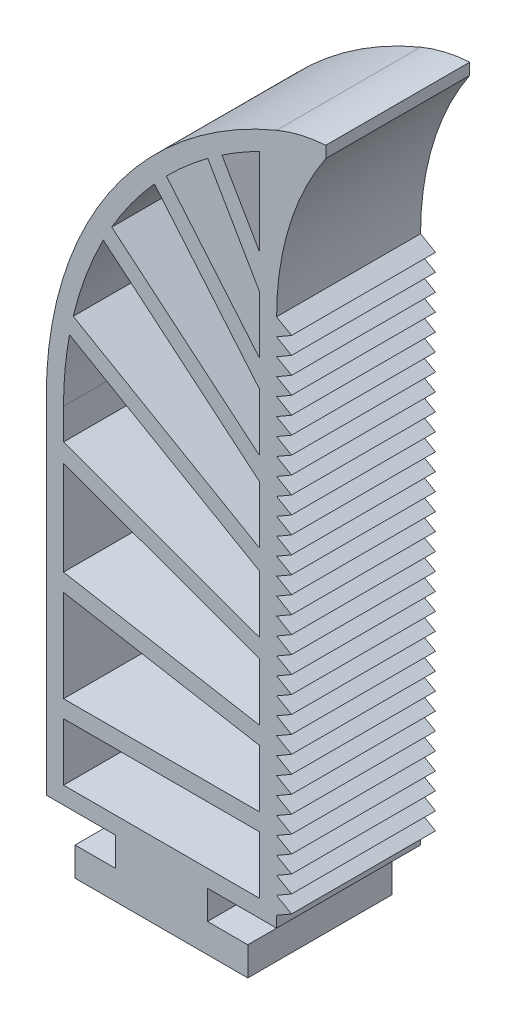
from build123d import *

# Parameters (mm, degrees)
BOSS_EXTRUDE1_DEPTH = 25
SKETCH3_W           = 34
SKETCH3_H           = 10
CUT_EXTRUDE1_DEPTH  = 134.88427839
CUT_EXTRUDE2_DEPTH  = 134.88427839
CUT_EXTRUDE3_DEPTH  = 134.88427839
CUT_EXTRUDE4_DEPTH  = 134.88427839
BOSS_EXTRUDE2_DEPTH = 25
BOSS_EXTRUDE3_DEPTH = 25
LPATTERN1_COUNT     = 30
LPATTERN1_PITCH     = 3
CUT_EXTRUDE5_DEPTH  = 138.359842306
CUT_EXTRUDE6_DEPTH  = 138.359842306
CUT_EXTRUDE7_DEPTH  = 138.359842306
CUT_EXTRUDE8_DEPTH  = 138.359842306


with BuildPart() as part:
    # Sketch2 → Boss-Extrude1 (new body)
    with BuildSketch(Plane.XY):
        with BuildLine():
            Line((-15, 0), (15, 0))
            Line((15, 0), (15, 5))
            Line((15, 5), (8, 5))
            Line((8, 5), (8, 10))
            Line((8, 10), (20, 10))
            Line((20, 10), (20, 130))
            ThreePointArc((20, 130), (-9.083269132, 106.055512755), (-20, 70))
            Line((-20, 70), (-20, 10))
            Line((-20, 10), (-8, 10))
            Line((-8, 10), (-8, 5))
            Line((-8, 5), (-15, 5))
            Line((-15, 5), (-15, 0))
        make_face()
    extrude(amount=BOSS_EXTRUDE1_DEPTH)

    # Sketch3 → Cut-Extrude1 (cut, through all)
    with BuildSketch(Plane.XY.offset(25)):
        with Locations((0, 18)):
            Rectangle(SKETCH3_W, SKETCH3_H)
    extrude(amount=-CUT_EXTRUDE1_DEPTH, mode=Mode.SUBTRACT)

    # Sketch4 → Cut-Extrude2 (cut, through all)
    with BuildSketch(Plane.XY.offset(25)):
        Polygon((-17, 26), (17, 26), (17, 36), (-17, 41.995117344), align=None)
    extrude(amount=-CUT_EXTRUDE2_DEPTH, mode=Mode.SUBTRACT)

    # Sketch5 → Cut-Extrude3 (cut, through all)
    with BuildSketch(Plane.XY.offset(25)):
        Polygon((-17, 45.04139718), (17, 39.046279836), (17, 49.046279836), (-17, 61.421267801), align=None)
    extrude(amount=-CUT_EXTRUDE3_DEPTH, mode=Mode.SUBTRACT)

    # Sketch6 → Cut-Extrude4 (cut, through all)
    with BuildSketch(Plane.XY.offset(25)):
        with BuildLine():
            Line((-17, 64.613801118), (17, 52.238813153))
            Line((17, 52.238813153), (17, 62.238813153))
            Line((17, 62.238813153), (-15.966701553, 81.272147169))
            ThreePointArc((-15.966701553, 81.272147169), (-16.741134976, 75.659704221), (-17, 70))
            Line((-17, 70), (-17, 64.613801118))
        make_face()
    extrude(amount=-CUT_EXTRUDE4_DEPTH, mode=Mode.SUBTRACT)

    # Sketch13 → Boss-Extrude2 (add)
    with BuildSketch(Plane.XY.offset(25)):
        with BuildLine():
            Line((28.543587015, 132.015112463), (28.543587015, 130.015112463))
            ThreePointArc((28.543587015, 130.015112463), (22.183163486, 116.610368534), (20, 101.934676234))
            Line((20, 101.934676234), (20, 130))
            ThreePointArc((20, 130), (24.189413282, 131.356828362), (28.543587015, 132.015112463))
        make_face()
    extrude(amount=-BOSS_EXTRUDE2_DEPTH)

    # Sketch15 → Boss-Extrude3 (add)
    with BuildSketch(Plane.XY.offset(25)):
        Polygon((20, 101.934676234), (22.598076211, 100.434676234), (20, 98.934676234), align=None)
    boss_extrude3 = extrude(amount=-BOSS_EXTRUDE3_DEPTH)

    # LPattern1: Boss-Extrude3 ×30
    with Locations(*[(0, -i * LPATTERN1_PITCH, 0) for i in range(1, LPATTERN1_COUNT)]):
        add(boss_extrude3)

    # Sketch17 → Cut-Extrude5 (cut, through all)
    with BuildSketch(Plane.XY.offset(25)):
        with BuildLine():
            Line((-15.314209237, 84.35953217), (17, 65.702914768))
            Line((17, 65.702914768), (17, 75.702914768))
            Line((17, 75.702914768), (-10.093752299, 98.43727233))
            ThreePointArc((-10.093752299, 98.43727233), (-13.131704676, 91.557015366), (-15.314209237, 84.35953217))
        make_face()
    extrude(amount=-CUT_EXTRUDE5_DEPTH, mode=Mode.SUBTRACT)

    # Sketch18 → Cut-Extrude6 (cut, through all)
    with BuildSketch(Plane.XY.offset(25)):
        with BuildLine():
            Line((-8.623988609, 101.120216028), (17, 79.619136636))
            Line((17, 79.619136636), (17, 89.619136636))
            Line((17, 89.619136636), (-1.21635527, 111.328543473))
            ThreePointArc((-1.21635527, 111.328543473), (-5.18043497, 106.413238612), (-8.623988609, 101.120216028))
        make_face()
    extrude(amount=-CUT_EXTRUDE6_DEPTH, mode=Mode.SUBTRACT)

    # Sketch19 → Cut-Extrude7 (cut, through all)
    with BuildSketch(Plane.XY.offset(25)):
        with BuildLine():
            Line((0.851852517, 113.530920893), (17, 94.286308117))
            Line((17, 94.286308117), (17, 104.286308117))
            Line((17, 104.286308117), (8.050664287, 119.787012266))
            ThreePointArc((8.050664287, 119.787012266), (4.330784185, 116.797594863), (0.851852517, 113.530920893))
        make_face()
    extrude(amount=-CUT_EXTRUDE7_DEPTH, mode=Mode.SUBTRACT)

    # Sketch21 → Cut-Extrude8 (cut, through all)
    with BuildSketch(Plane.XY.offset(25)):
        with BuildLine():
            Line((10.512523927, 121.522946287), (17, 110.286308117))
            Line((17, 110.286308117), (17, 125.317266744))
            ThreePointArc((17, 125.317266744), (13.698715946, 123.518497892), (10.512523927, 121.522946287))
        make_face()
    extrude(amount=-CUT_EXTRUDE8_DEPTH, mode=Mode.SUBTRACT)


solid = part.part
